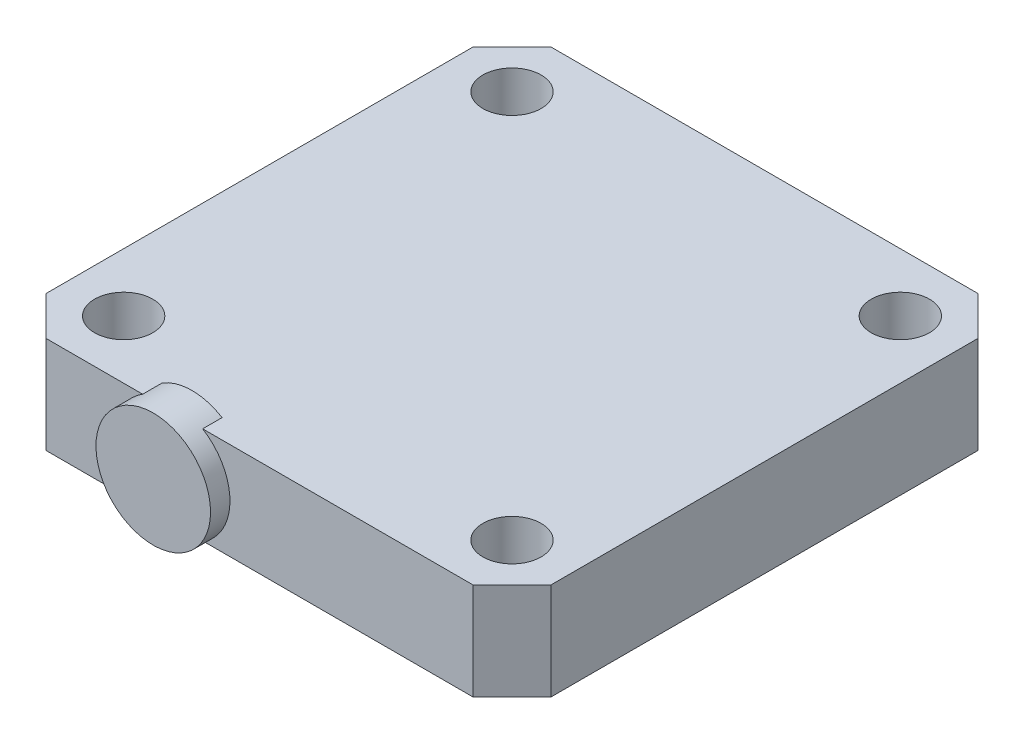
from build123d import *

# Parameters (mm, degrees)
SKETCH1_R           = 1.5
BOSS_EXTRUDE1_DEPTH = 5
SKETCH2_R           = 2.950338073
BOSS_EXTRUDE2_DEPTH = 1


with BuildPart() as part:
    # Sketch1 → Boss-Extrude1 (new body)
    with BuildSketch(Plane(origin=(0, 0, 0), x_dir=(1, 0, 0), z_dir=(0, 1, 0))):
        Polygon((-11, 13), (-13, 11), (-13, -11), (-11, -13), (11, -13), (13, -11), (13, 11), (11, 13), align=None)
        with Locations(Location((-10, 10, 0), (0, 0, 270))):
            Circle(SKETCH1_R, mode=Mode.SUBTRACT)
        with Locations(Location((10, 10, 0), (0, 0, 270))):
            Circle(SKETCH1_R, mode=Mode.SUBTRACT)
        with Locations(Location((10, -10, 0), (0, 0, 270))):
            Circle(SKETCH1_R, mode=Mode.SUBTRACT)
        with Locations(Location((-10, -10, 0), (0, 0, 270))):
            Circle(SKETCH1_R, mode=Mode.SUBTRACT)
    extrude(amount=BOSS_EXTRUDE1_DEPTH)

    # Sketch2 → Boss-Extrude2 (add, symmetric)
    with BuildSketch(Plane.XY.offset(13)):
        with Locations(Location((-4.476260218, 2.486184382, 0), (0, 0, 237.423977883))):
            Circle(SKETCH2_R)
    extrude(amount=BOSS_EXTRUDE2_DEPTH, both=True)


solid = part.part
